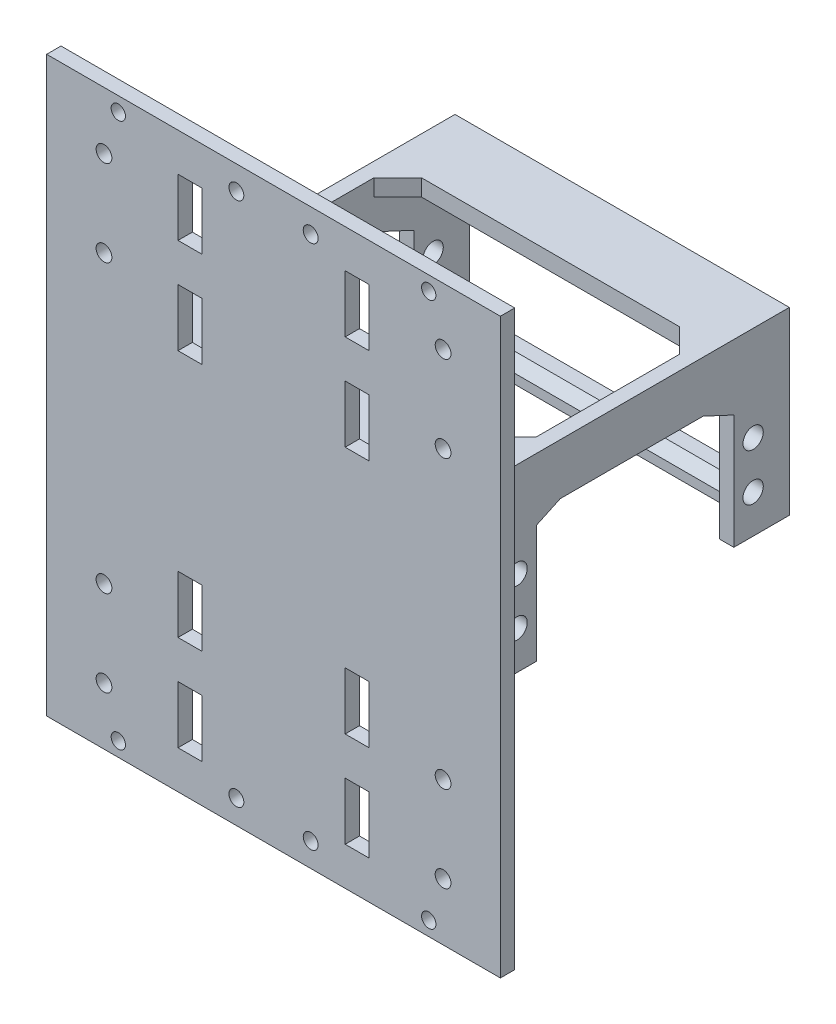
from build123d import *
from OCP.BRepFilletAPI import BRepFilletAPI_MakeChamfer

# Parameters (mm, degrees)
SKETCH_1_W          = 95
SKETCH_1_H          = 120
EXTRUDE_1_DEPTH     = 3
SKETCH_2_W          = 3
SKETCH_2_H          = 37.7
EXTRUDE_2_DEPTH     = 70
SKETCH_4_R          = 1.5
CUT_EXTRUDE_2_DEPTH = 10
SKETCH_18_W         = 5
SKETCH_18_H         = 12
CUT_EXTRUDE_5_DEPTH = 20
SKETCH_21_R         = 1.65
CUT_EXTRUDE_6_DEPTH = 10
SKETCH_22_R         = 1.56
CUT_EXTRUDE_7_DEPTH = 10
SKETCH_3_R          = 2.125
CUT_EXTRUDE_8_DEPTH = 80
SKETCH_23_W         = 41.335758236
SKETCH_23_H         = 27
CUT_EXTRUDE_9_DEPTH = 80
CHAMFER_4_SIZE      = 3
CHAMFER_4_SIZE2     = 6.433520762
CHAMFER_5_SIZE      = 5
CHAMFER_5_SIZE2     = 2.331538291
SKETCH_24_W         = 15
SKETCH_24_H         = 3.5
EXTRUDE_3_DEPTH     = 64
CHAMFER_7_SIZE      = 5
SKETCH_26_W         = 64
SKETCH_26_H         = 4
EXTRUDE_5_DEPTH     = 8
SKETCH_5_W          = 64
SKETCH_5_H          = 4
EXTRUDE_6_DEPTH     = 5
CHAMFER_9_SIZE      = 2


with BuildPart() as part:
    # 草图1 → 凸台-拉伸1 (new body)
    with BuildSketch(Plane.XY):
        Rectangle(SKETCH_1_W, SKETCH_1_H)
    extrude(amount=EXTRUDE_1_DEPTH)

    # 草图2 → 凸台-拉伸2 (add)
    with BuildSketch(Plane(origin=(0, 0, 0), x_dir=(-1, 0, 0), z_dir=(0, 0, -1))):
        with Locations((-33.5, 0)):
            Rectangle(SKETCH_2_W, SKETCH_2_H)
        with Locations((33.5, 0)):
            Rectangle(SKETCH_2_W, SKETCH_2_H)
    extrude(amount=EXTRUDE_2_DEPTH)

    # 草图4 → 切除-拉伸2 (cut)
    with BuildSketch(Plane.XY.offset(3)):
        with Locations((-32.5, 57)):
            Circle(SKETCH_4_R)
        with Locations(Location((32.5, 57, 0), (0, 0, 180))):
            Circle(SKETCH_4_R)
        with Locations((32.5, -57)):
            Circle(SKETCH_4_R)
        with Locations(Location((-32.5, -57, 0), (0, 0, 180))):
            Circle(SKETCH_4_R)
    extrude(amount=-CUT_EXTRUDE_2_DEPTH, mode=Mode.SUBTRACT)

    # 草图18 → 切除-拉伸5 (cut)
    with BuildSketch(Plane.XY.offset(3)):
        with Locations((-17.5, -26)):
            Rectangle(SKETCH_18_W, SKETCH_18_H)
        with Locations((17.5, -26)):
            Rectangle(SKETCH_18_W, SKETCH_18_H)
        with Locations((-17.5, -46)):
            Rectangle(SKETCH_18_W, SKETCH_18_H)
        with Locations((17.5, -46)):
            Rectangle(SKETCH_18_W, SKETCH_18_H)
        with Locations((17.5, 46)):
            Rectangle(SKETCH_18_W, SKETCH_18_H)
        with Locations((-17.5, 46)):
            Rectangle(SKETCH_18_W, SKETCH_18_H)
        with Locations((17.5, 26)):
            Rectangle(SKETCH_18_W, SKETCH_18_H)
        with Locations((-17.5, 26)):
            Rectangle(SKETCH_18_W, SKETCH_18_H)
    extrude(amount=-CUT_EXTRUDE_5_DEPTH, mode=Mode.SUBTRACT)

    # 草图21 → 切除-拉伸6 (cut)
    with BuildSketch(Plane.XY.offset(3)):
        with Locations((-35.5, -48)):
            Circle(SKETCH_21_R)
        with Locations((-35.5, -30)):
            Circle(SKETCH_21_R)
        with Locations(Location((35.5, -30, 0), (0, 0, 180))):
            Circle(SKETCH_21_R)
        with Locations(Location((35.5, -48, 0), (0, 0, 180))):
            Circle(SKETCH_21_R)
        with Locations((35.5, 48)):
            Circle(SKETCH_21_R)
        with Locations((35.5, 30)):
            Circle(SKETCH_21_R)
        with Locations(Location((-35.5, 30, 0), (0, 0, 180))):
            Circle(SKETCH_21_R)
        with Locations(Location((-35.5, 48, 0), (0, 0, 180))):
            Circle(SKETCH_21_R)
    extrude(amount=-CUT_EXTRUDE_6_DEPTH, mode=Mode.SUBTRACT)

    # 草图22 → 切除-拉伸7 (cut)
    with BuildSketch(Plane.XY.offset(3)):
        with Locations((-7.78, -55)):
            Circle(SKETCH_22_R)
        with Locations(Location((7.78, -55, 0), (0, 0, 180))):
            Circle(SKETCH_22_R)
        with Locations((7.78, 55)):
            Circle(SKETCH_22_R)
        with Locations(Location((-7.78, 55, 0), (0, 0, 180))):
            Circle(SKETCH_22_R)
    extrude(amount=-CUT_EXTRUDE_7_DEPTH, mode=Mode.SUBTRACT)

    # 草图3 → 切除-拉伸8 (cut)
    with BuildSketch(Plane(origin=(35, 0, 0), x_dir=(0, 0, -1), z_dir=(1, 0, 0))):
        with Locations((13, -1)):
            Circle(SKETCH_3_R)
        with Locations((13, -10.85)):
            Circle(SKETCH_3_R)
        with Locations((62.42, -1)):
            Circle(SKETCH_3_R)
        with Locations((62.42, -10.85)):
            Circle(SKETCH_3_R)
    extrude(amount=-CUT_EXTRUDE_8_DEPTH, mode=Mode.SUBTRACT)

    # 草图23 → 切除-拉伸9 (cut)
    with BuildSketch(Plane(origin=(35, 0, 0), x_dir=(0, 0, -1), z_dir=(1, 0, 0))):
        with Locations((37.71, -5.35)):
            Rectangle(SKETCH_23_W, SKETCH_23_H)
    extrude(amount=-CUT_EXTRUDE_9_DEPTH, mode=Mode.SUBTRACT)

    # 倒角4: one chamfer whose edges measure the first distance from different faces: ONE call of the kernel's chamfer builder (chamfer() names one face for all edges)
    chamfer_4_edges_1 = [part.edges().sort_by_distance(p)[0] for p in [
        (-33.5, 8.15, -58.377879118),
    ]]
    chamfer_4_side_1 = [part.faces().sort_by_distance(p)[0] for p in [
        (-33.5, -5.35, -58.377879118),
    ]]
    chamfer_4_edges_2 = [part.edges().sort_by_distance(p)[0] for p in [
        (33.5, 8.15, -58.377879118),
    ]]
    chamfer_4_side_2 = [part.faces().sort_by_distance(p)[0] for p in [
        (33.5, -5.35, -58.377879118),
    ]]
    chamfer_4 = BRepFilletAPI_MakeChamfer(part.part.solid().wrapped)
    for e in chamfer_4_edges_1:
        chamfer_4.Add(CHAMFER_4_SIZE, CHAMFER_4_SIZE2, e.wrapped, chamfer_4_side_1[0].wrapped)  # the first distance lies on this face
    for e in chamfer_4_edges_2:
        chamfer_4.Add(CHAMFER_4_SIZE, CHAMFER_4_SIZE2, e.wrapped, chamfer_4_side_2[0].wrapped)  # the first distance lies on this face
    add(Compound.cast(chamfer_4.Shape()), mode=Mode.REPLACE)

    # 倒角5: one chamfer whose edges measure the first distance from different faces: ONE call of the kernel's chamfer builder (chamfer() names one face for all edges)
    chamfer_5_edges_1 = [part.edges().sort_by_distance(p)[0] for p in [
        (-33.5, 8.15, -17.042120882),
    ]]
    chamfer_5_side_1 = [part.faces().sort_by_distance(p)[0] for p in [
        (-33.5, 8.15, -34.493239619),
    ]]
    chamfer_5_edges_2 = [part.edges().sort_by_distance(p)[0] for p in [
        (33.5, 8.15, -17.042120882),
    ]]
    chamfer_5_side_2 = [part.faces().sort_by_distance(p)[0] for p in [
        (33.5, 8.15, -34.493239619),
    ]]
    chamfer_5 = BRepFilletAPI_MakeChamfer(part.part.solid().wrapped)
    for e in chamfer_5_edges_1:
        chamfer_5.Add(CHAMFER_5_SIZE, CHAMFER_5_SIZE2, e.wrapped, chamfer_5_side_1[0].wrapped)  # the first distance lies on this face
    for e in chamfer_5_edges_2:
        chamfer_5.Add(CHAMFER_5_SIZE, CHAMFER_5_SIZE2, e.wrapped, chamfer_5_side_2[0].wrapped)  # the first distance lies on this face
    add(Compound.cast(chamfer_5.Shape()), mode=Mode.REPLACE)

    # 草图24 → 凸台-拉伸3 (add)
    with BuildSketch(Plane(origin=(-32, 0, 0), x_dir=(0, 0, -1), z_dir=(1, 0, 0))):
        with Locations((7.5, 17.1)):
            Rectangle(SKETCH_24_W, SKETCH_24_H)
        with Locations((62.5, 17.1)):
            Rectangle(SKETCH_24_W, SKETCH_24_H)
    extrude(amount=EXTRUDE_3_DEPTH)

    # 倒角7
    chamfer_7_edges = [part.edges().sort_by_distance(p)[0] for p in [
        (-32, 17.1, -15),
        (32, 17.1, -15),
        (-32, 17.1, -55),
        (32, 17.1, -55),
    ]]
    chamfer(chamfer_7_edges, length=CHAMFER_7_SIZE)

    # 草图26 → 凸台-拉伸5 (add)
    with BuildSketch(Plane(origin=(0, 0, 0), x_dir=(-1, 0, 0), z_dir=(0, 0, -1))):
        with Locations((0, -16.85)):
            Rectangle(SKETCH_26_W, SKETCH_26_H)
    extrude(amount=EXTRUDE_5_DEPTH)

    # 草图5 → 凸台-拉伸6 (add)
    with BuildSketch(Plane(origin=(0, 0, -70), x_dir=(-1, 0, 0), z_dir=(0, 0, -1))):
        with Locations((0, -16.85)):
            Rectangle(SKETCH_5_W, SKETCH_5_H)
    extrude(amount=-EXTRUDE_6_DEPTH)

    # 倒角9
    chamfer_9_edges = [part.edges().sort_by_distance(p)[0] for p in [
        (0, -14.85, -65),
    ]]
    chamfer(chamfer_9_edges, length=CHAMFER_9_SIZE)


solid = part.part
